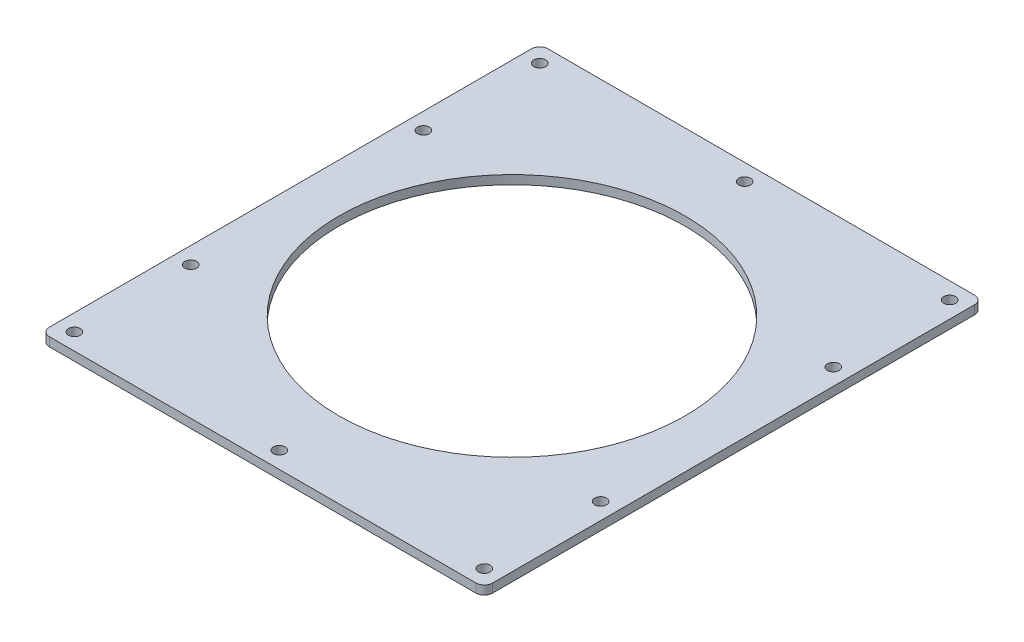
from build123d import *

# Parameters (mm, degrees)
SKETCH1_W           = 160
SKETCH1_H           = 180
SKETCH1_R           = 62.5
SKETCH1_R_2         = 2.125
BOSS_EXTRUDE1_DEPTH = 3.175
FILLET1_R           = 3


with BuildPart() as part:
    # Sketch1 → Boss-Extrude1 (new body)
    with BuildSketch(Plane(origin=(0, 0, 0), x_dir=(1, 0, 0), z_dir=(0, 1, 0))):
        Rectangle(SKETCH1_W, SKETCH1_H)
        with Locations(Location((0, 0, 0), (0, 0, 270))):
            Circle(SKETCH1_R, mode=Mode.SUBTRACT)
        with Locations(Location((-74, -84, 0), (0, 0, 270))):
            Circle(SKETCH1_R_2, mode=Mode.SUBTRACT)
        with Locations(Location((-74, -42, 0), (0, 0, 270))):
            Circle(SKETCH1_R_2, mode=Mode.SUBTRACT)
        with Locations(Location((-74, 84, 0), (0, 0, 90))):
            Circle(SKETCH1_R_2, mode=Mode.SUBTRACT)
        with Locations(Location((74, -84, 0), (0, 0, 90))):
            Circle(SKETCH1_R_2, mode=Mode.SUBTRACT)
        with Locations(Location((74, -42, 0), (0, 0, 90))):
            Circle(SKETCH1_R_2, mode=Mode.SUBTRACT)
        with Locations(Location((74, 84, 0), (0, 0, 270))):
            Circle(SKETCH1_R_2, mode=Mode.SUBTRACT)
        with Locations(Location((0, -84, 0), (0, 0, 270))):
            Circle(SKETCH1_R_2, mode=Mode.SUBTRACT)
        with Locations(Location((0, 84, 0), (0, 0, 90))):
            Circle(SKETCH1_R_2, mode=Mode.SUBTRACT)
        with Locations(Location((74, 42, 0), (0, 0, 270))):
            Circle(SKETCH1_R_2, mode=Mode.SUBTRACT)
        with Locations(Location((-74, 42, 0), (0, 0, 90))):
            Circle(SKETCH1_R_2, mode=Mode.SUBTRACT)
    extrude(amount=BOSS_EXTRUDE1_DEPTH)

    # Fillet1
    fillet1_edges = [part.edges().sort_by_distance(p)[0] for p in [
        (80, 1.5875, 90),
        (-80, 1.5875, 90),
        (-80, 1.5875, -90),
        (80, 1.5875, -90),
    ]]
    fillet(fillet1_edges, radius=FILLET1_R)


solid = part.part
